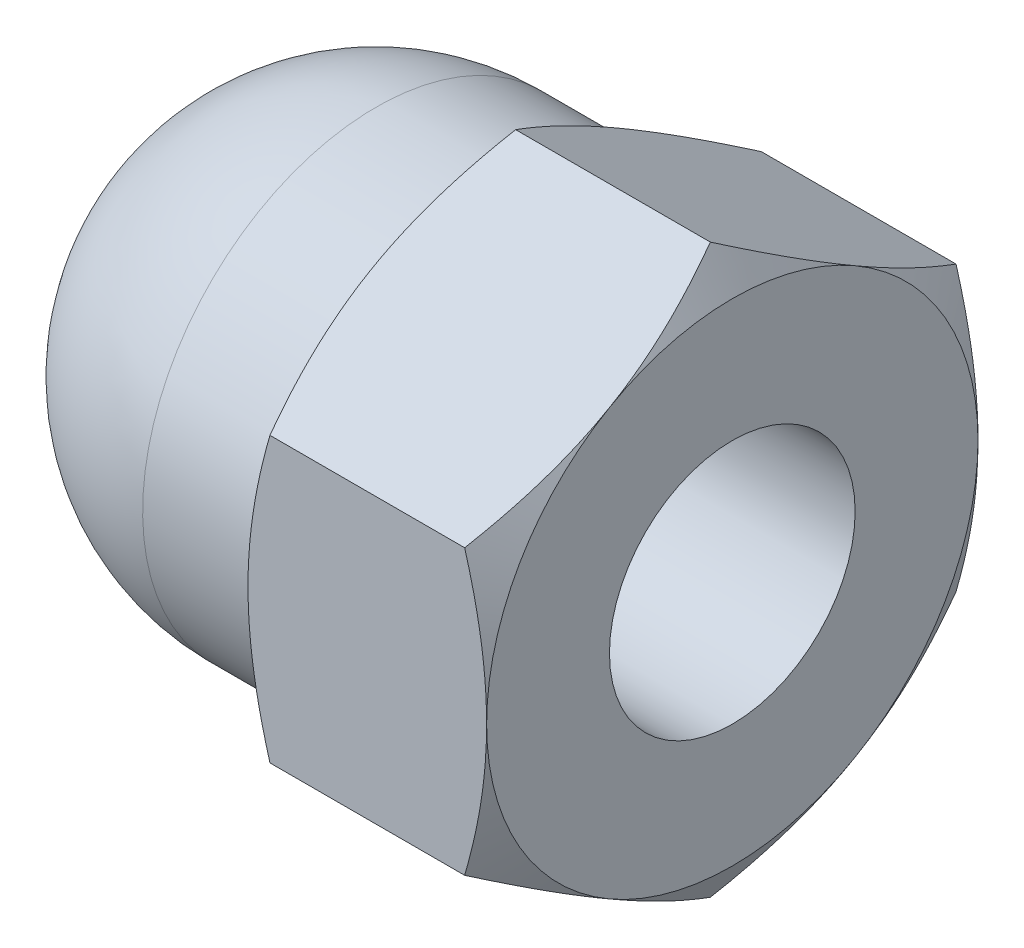
from build123d import *

# Parameters (mm, degrees)
BOSS_EXTRUDE1_DEPTH = 12


with BuildPart() as part:
    # Sketch1 → Boss-Extrude1 (new body)
    with BuildSketch(Plane(origin=(0, 0, 0), x_dir=(0, 0, -1), z_dir=(1, 0, 0))):
        Polygon((0, 5.773502692), (-5, 2.886751346), (-5, -2.886751346), (0, -5.773502692), (5, -2.886751346), (5, 2.886751346), align=None)
    extrude(amount=-BOSS_EXTRUDE1_DEPTH)

    # Sketch2 → Cut-Revolve4 (revolve, cut)
    with BuildSketch(Plane.XY):
        Polygon((0, 5), (-0.446581987, 5.773502692), (0, 5.773502692), align=None)
        with BuildLine():
            Line((-4.409080445, 5.773502692), (-13.863248654, 5.773502692))
            Line((-13.863248654, 5.773502692), (-13.863248654, 0))
            Line((-13.863248654, 0), (-12, 0))
            ThreePointArc((-12, 0), (-10.608757211, 3.358757211), (-7.25, 4.75))
            Line((-7.25, 4.75), (-5, 4.75))
            Line((-5, 4.75), (-4.409080445, 5.773502692))
        make_face()
        Polygon((-10.136751346, 0), (-8.693375673, 2.5), (0, 2.5), (0, 0), align=None)
    revolve(axis=Axis((-12, 0, 0), (1, 0, 0)), mode=Mode.SUBTRACT)


solid = part.part
